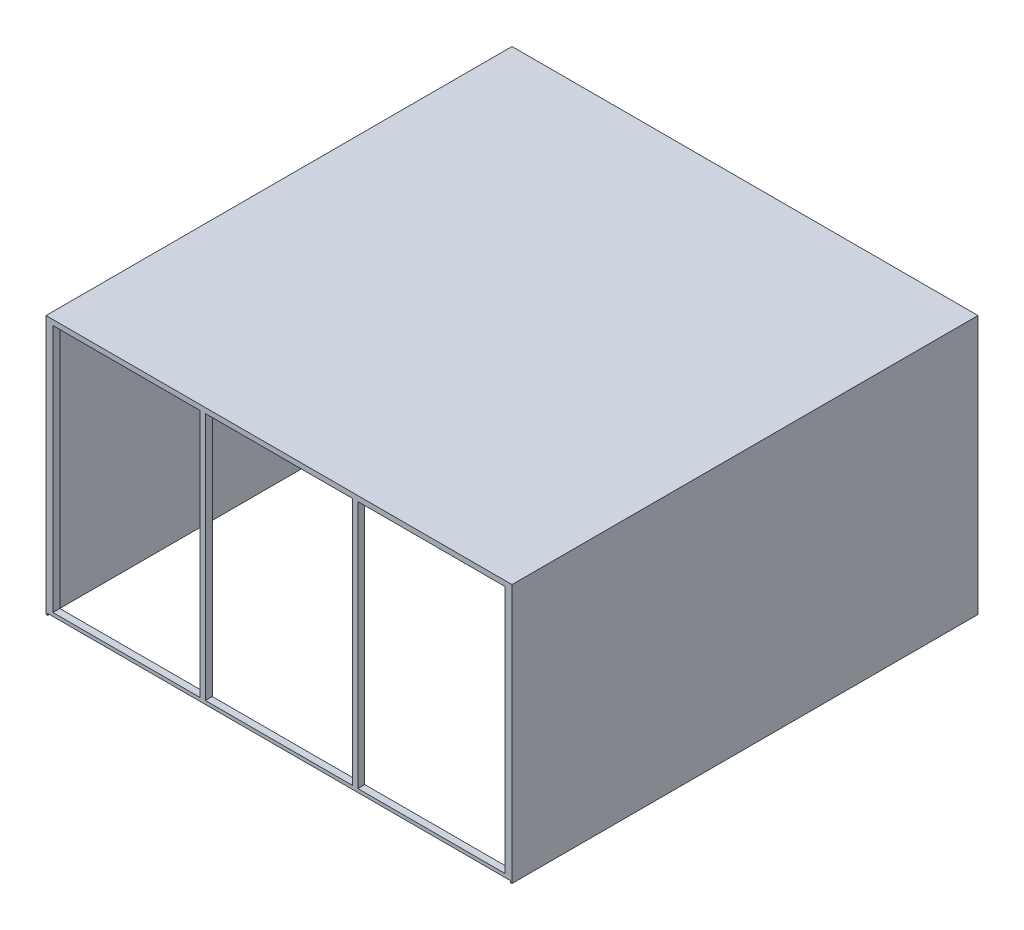
from build123d import *

# Parameters (mm, degrees)
SKETCH1_W           = 675
SKETCH1_H           = 675
BOSS_EXTRUDE1_DEPTH = 375
CUT_EXTRUDE3_START  = -10
SKETCH4_W           = 670
SKETCH4_H           = 370
CUT_EXTRUDE3_DEPTH  = 662.5
SKETCH6_W           = 670
SKETCH6_H           = 5
CUT_EXTRUDE4_DEPTH  = 670
SKETCH11_W          = 213.34
SKETCH11_H          = 360
SKETCH11_W_2        = 213.33
CUT_EXTRUDE6_DEPTH  = 10


with BuildPart() as part:
    # Sketch1 → Boss-Extrude1 (new body)
    with BuildSketch(Plane(origin=(0, 0, 0), x_dir=(1, 0, 0), z_dir=(0, 1, 0))):
        with Locations((0, 337.5)):
            Rectangle(SKETCH1_W, SKETCH1_H)
    extrude(amount=BOSS_EXTRUDE1_DEPTH)

    # Sketch4 → Cut-Extrude3 (cut)
    with BuildSketch(Plane.XY.offset(CUT_EXTRUDE3_START)):
        with Locations((0, 187.5)):
            Rectangle(SKETCH4_W, SKETCH4_H)
    extrude(amount=-CUT_EXTRUDE3_DEPTH, mode=Mode.SUBTRACT)

    # Sketch6 → Cut-Extrude4 (cut)
    with BuildSketch(Plane.XY):
        Rectangle(SKETCH6_W, SKETCH6_H)
    extrude(amount=-CUT_EXTRUDE4_DEPTH, mode=Mode.SUBTRACT)

    # Sketch11 → Cut-Extrude6 (cut)
    with BuildSketch(Plane.XY):
        with Locations((0, 187.5)):
            Rectangle(SKETCH11_W, SKETCH11_H)
        with Locations((-220.835, 187.5)):
            Rectangle(SKETCH11_W_2, SKETCH11_H)
        with Locations((220.835, 187.5)):
            Rectangle(SKETCH11_W_2, SKETCH11_H)
    extrude(amount=-CUT_EXTRUDE6_DEPTH, mode=Mode.SUBTRACT)


solid = part.part
